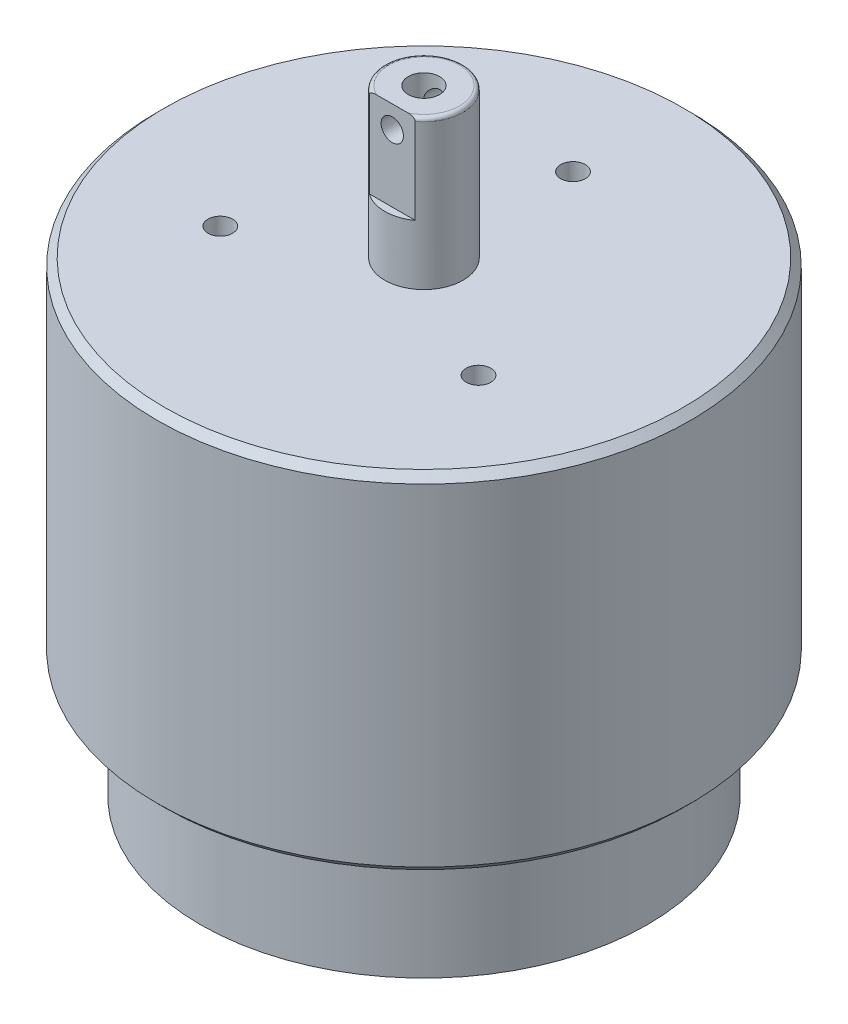
from build123d import *

# Parameters (mm, degrees)
SKETCH_1_R             = 35.8
EXTRUDE_1_DEPTH        = 23.25
HOLE_WIZARD_M4_1_D     = 3.3
HOLE_WIZARD_M4_1_DEPTH = 11.5
HOLE_WIZARD_M4_1_TIP   = 0.991420021
SKETCH_4_R             = 5.25
EXTRUDE_2_DEPTH        = 20
FILLET_1_R             = 0.5
SKETCH_5_W             = 9.627947462
SKETCH_5_H             = 2
CUT_EXTRUDE_1_DEPTH    = 12
HOLE_WIZARD_M5_1_D     = 4.2
HOLE_WIZARD_M5_1_DEPTH = 14
HOLE_WIZARD_M5_1_TIP   = 1.2618073
CHAMFER_1_SIZE         = 1
SKETCH_7_R             = 30
EXTRUDE_3_DEPTH        = 17
CHAMFER_2_SIZE         = 1
CHAMFER_3_SIZE         = 1
CHAMFER_3_SIZE2        = 3
SKETCH_8_R             = 1.5
CUT_EXTRUDE_2_DEPTH    = 69.965244933


with BuildPart() as part:
    # 草图1 → 凸台-拉伸1 (new, symmetric)
    with BuildSketch(Plane(origin=(0, 0, 0), x_dir=(1, 0, 0), z_dir=(0, 1, 0))):
        with Locations(Location((0, 0, 0), (0, 0, 90))):
            Circle(SKETCH_1_R)
    extrude(amount=EXTRUDE_1_DEPTH, both=True)

    # M4 螺纹孔1
    with Locations(Plane(origin=(0, 23.25, -20), x_dir=(0, 0, 1), z_dir=(0, 1, 0))):
        with Locations((0, 0), (30, -17.320508076), (30, 17.320508076)):
            Hole(HOLE_WIZARD_M4_1_D / 2, depth=HOLE_WIZARD_M4_1_DEPTH)
            with Locations((0, 0, -(HOLE_WIZARD_M4_1_DEPTH + HOLE_WIZARD_M4_1_TIP / 2))):  # 118° drill point
                Cone(0, HOLE_WIZARD_M4_1_D / 2, HOLE_WIZARD_M4_1_TIP, mode=Mode.SUBTRACT)

    # 草图4 → 凸台-拉伸2 (add)
    with BuildSketch(Plane(origin=(0, 23.25, 0), x_dir=(1, 0, 0), z_dir=(0, 1, 0))):
        with Locations(Location((0, 0, 0), (0, 0, 270))):
            Circle(SKETCH_4_R)
    extrude(amount=EXTRUDE_2_DEPTH)

    # 圆角1
    fillet_1_edges = [part.edges().sort_by_distance(p)[0] for p in [
        (0, 43.25, -5.25),
    ]]
    fillet(fillet_1_edges, radius=FILLET_1_R)

    # 草图5 → 切除-拉伸1 (cut)
    with BuildSketch(Plane(origin=(0, 43.25, 0), x_dir=(1, 0, 0), z_dir=(0, 1, 0))):
        with Locations((0, -5.25)):
            Rectangle(SKETCH_5_W, SKETCH_5_H)
    extrude(amount=-CUT_EXTRUDE_1_DEPTH, mode=Mode.SUBTRACT)

    # M5 螺纹孔1
    with Locations(Plane.ZX.offset(43.25)):
        with Locations((0, 0)):
            Hole(HOLE_WIZARD_M5_1_D / 2, depth=HOLE_WIZARD_M5_1_DEPTH)
            with Locations((0, 0, -(HOLE_WIZARD_M5_1_DEPTH + HOLE_WIZARD_M5_1_TIP / 2))):  # 118° drill point
                Cone(0, HOLE_WIZARD_M5_1_D / 2, HOLE_WIZARD_M5_1_TIP, mode=Mode.SUBTRACT)

    # 倒角1
    chamfer_1_edges = [part.edges().sort_by_distance(p)[0] for p in [
        (0, 23.25, 35.8),
    ]]
    chamfer(chamfer_1_edges, length=CHAMFER_1_SIZE)

    # 草图7 → 凸台-拉伸3 (add)
    with BuildSketch(Plane.XZ.offset(23.25)):
        with Locations(Location((0, 0, 0), (0, 0, 90))):
            Circle(SKETCH_7_R)
    extrude(amount=EXTRUDE_3_DEPTH)

    # 倒角2
    chamfer_2_edges = [part.edges().sort_by_distance(p)[0] for p in [
        (0, -23.25, 35.8),
    ]]
    chamfer(chamfer_2_edges, length=CHAMFER_2_SIZE)

    # 倒角3
    chamfer_3_edges = [part.edges().sort_by_distance(p)[0] for p in [
        (0, -40.25, -30),
    ]]
    chamfer_3_side = [part.faces().sort_by_distance(p)[0] for p in [
        (0, -31.75, -30),
    ]]
    chamfer(chamfer_3_edges, length=CHAMFER_3_SIZE, length2=CHAMFER_3_SIZE2, reference=chamfer_3_side[0])

    # 草图8 → 切除-拉伸2 (cut, through all)
    with BuildSketch(Plane.XY.offset(4.25)):
        with Locations((0, 40.25)):
            Circle(SKETCH_8_R)
    extrude(amount=-CUT_EXTRUDE_2_DEPTH, mode=Mode.SUBTRACT)


solid = part.part
